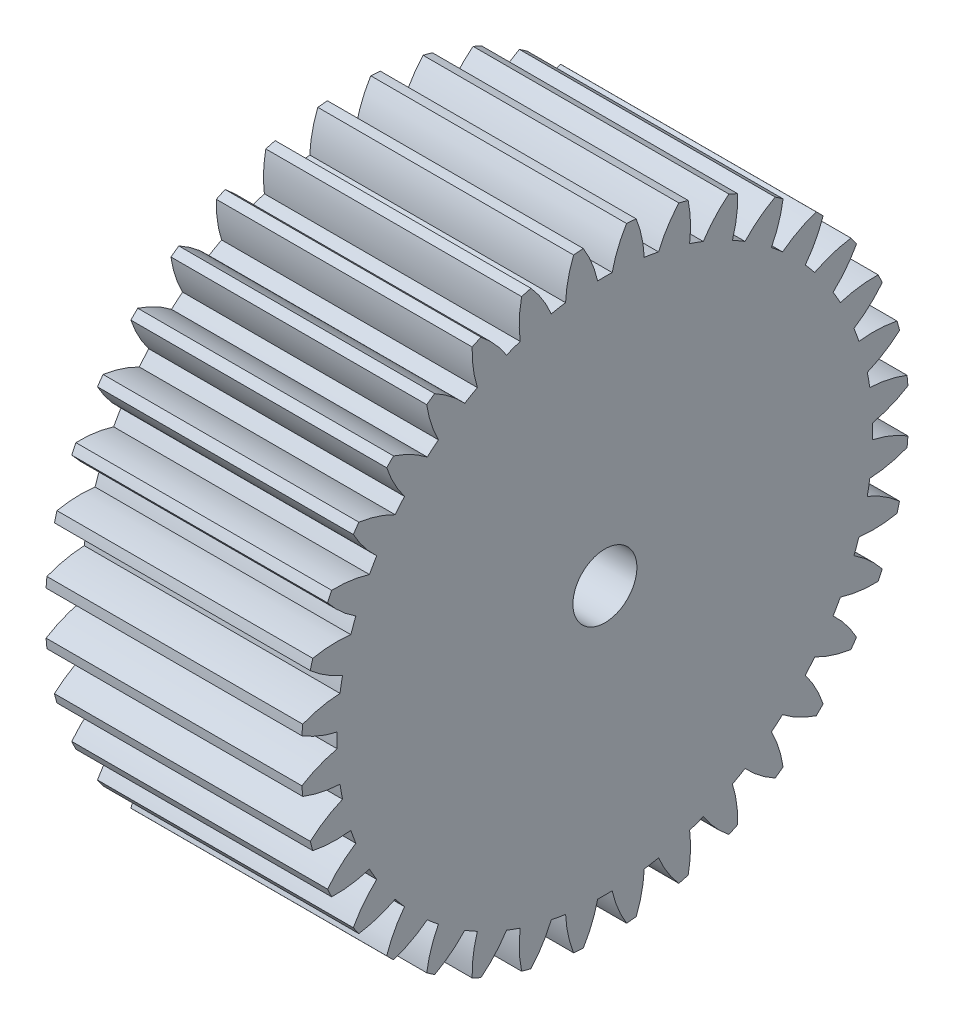
from build123d import *

# Parameters (mm, degrees)
BASPROSKE_W     = 16
BASPROSKE_H     = 19
TOOTHCUT_DEPTH  = 32.272991542
TEETHCUTS_COUNT = 36
TEETHCUTS_ANGLE = 350
BORSKE_R        = 2
BORE_DEPTH      = 50.0000508


with BuildPart() as part:
    # BasProSke → Base-Revolve (revolve)
    with BuildSketch(Plane(origin=(0, 0, 0), x_dir=(1, 0, 0), z_dir=(0, 1, 0)), mode=Mode.PRIVATE) as base_revolve_sk:
        with Locations((8, 9.5)):
            Rectangle(BASPROSKE_W, BASPROSKE_H)
    revolve(base_revolve_sk.sketch.rotate(Axis((-10, 0, 0), (1, 0, 0)), 180), axis=Axis((-10, 0, 0), (1, 0, 0)))

    # TooCutSke → ToothCut (cut, through all)
    with BuildSketch(Plane(origin=(0, 0, 0), x_dir=(0, 0, -1), z_dir=(1, 0, 0))):
        with BuildLine():
            ThreePointArc((0.454664826, 16.742827745), (0, 16.749), (-0.454664826, 16.742827745))
            ThreePointArc((-0.454664826, 16.742827745), (-0.817558311, 17.898033097), (-1.368909141, 18.976088452))
            ThreePointArc((-1.368909141, 18.976088452), (0, 19.0254), (1.368909141, 18.976088452))
            ThreePointArc((1.368909141, 18.976088452), (0.817558311, 17.898033097), (0.454664826, 16.742827745))
        make_face()
    toothcut = extrude(amount=TOOTHCUT_DEPTH, mode=Mode.SUBTRACT)

    # TeethCuts: ToothCut ×36 about axis
    teethcuts_axis = Axis((-10, 0, 0), (1, 0, 0))
    for i in range(1, TEETHCUTS_COUNT):
        add(toothcut.rotate(teethcuts_axis, i * TEETHCUTS_ANGLE / (TEETHCUTS_COUNT - 1)), mode=Mode.SUBTRACT)

    # BorSke → Bore (cut, symmetric)
    with BuildSketch(Plane(origin=(0, 0, 0), x_dir=(0, 0, -1), z_dir=(1, 0, 0))):
        with Locations(Location((0, 0, 0), (0, 0, 180))):
            Circle(BORSKE_R)
    extrude(amount=BORE_DEPTH, both=True, mode=Mode.SUBTRACT)


solid = part.part
